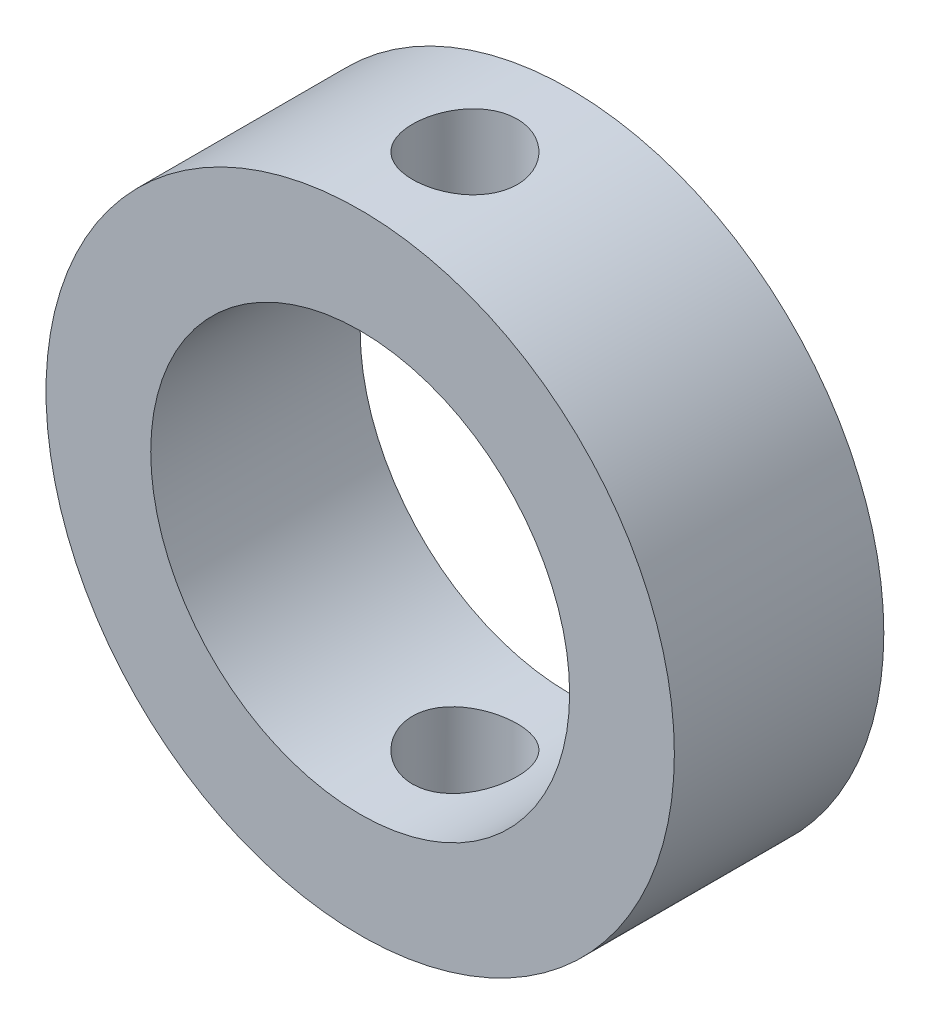
from build123d import *

# Parameters (mm, degrees)
SKETCH1_R               = 15
SKETCH1_R_2             = 10
BOSS_EXTRUDE2_DEPTH     = 10
CUT_EXTRUDE1_DEPTH      = 24.452078799
CUT_EXTRUDE1_DEPTH_BACK = 24.452078799
SKETCH3_R               = 2.5


with BuildPart() as part:
    # Sketch1 → Boss-Extrude2 (new body)
    with BuildSketch(Plane.XY):
        Circle(SKETCH1_R)
        Circle(SKETCH1_R_2, mode=Mode.SUBTRACT)
    extrude(amount=BOSS_EXTRUDE2_DEPTH)

    # Sketch3 → Cut-Extrude1 (cut, two sides: drawn at the far end of the back side and taken through both)
    with BuildSketch(Plane(origin=(0, 0, 0), x_dir=(1, 0, 0), z_dir=(0, 1, 0)).offset(-CUT_EXTRUDE1_DEPTH_BACK)):
        with Locations(Location((0, -5, 0), (0, 0, 270))):
            Circle(SKETCH3_R)
    extrude(amount=CUT_EXTRUDE1_DEPTH + CUT_EXTRUDE1_DEPTH_BACK, mode=Mode.SUBTRACT)


solid = part.part
